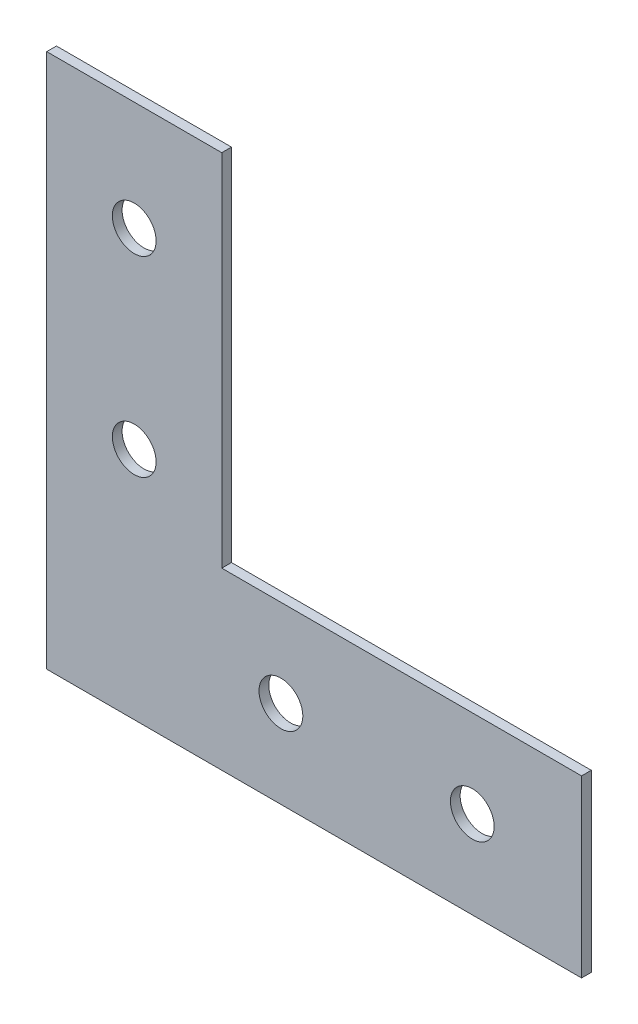
from build123d import *

# Parameters (mm, degrees)
SKETCH_1_W          = 36
SKETCH_1_H          = 110
EXTRUDE_1_DEPTH     = 2
SKETCH_2_W          = 110
SKETCH_2_H          = 36
EXTRUDE_2_DEPTH     = 2
SKETCH_3_R          = 4.5
CUT_EXTRUDE_1_DEPTH = 108.205410311


with BuildPart() as part:
    # 草图1 → 凸台-拉伸1 (new body)
    with BuildSketch(Plane.XY):
        Rectangle(SKETCH_1_W, SKETCH_1_H)
    extrude(amount=EXTRUDE_1_DEPTH)

    # 草图2 → 凸台-拉伸2 (add)
    with BuildSketch(Plane.XY.offset(2)):
        with Locations((37, -37)):
            Rectangle(SKETCH_2_W, SKETCH_2_H)
    extrude(amount=-EXTRUDE_2_DEPTH)

    # 草图3 → 切除-拉伸1 (cut, through all)
    with BuildSketch(Plane.XY.offset(2)):
        with Locations((0, 32.525719086)):
            Circle(SKETCH_3_R)
        with Locations((0, -6.833134262)):
            Circle(SKETCH_3_R)
        with Locations(Location((30.166865738, -37, 0), (0, 0, 180))):
            Circle(SKETCH_3_R)
        with Locations(Location((69.525719086, -37, 0), (0, 0, 180))):
            Circle(SKETCH_3_R)
    extrude(amount=-CUT_EXTRUDE_1_DEPTH, mode=Mode.SUBTRACT)


solid = part.part
